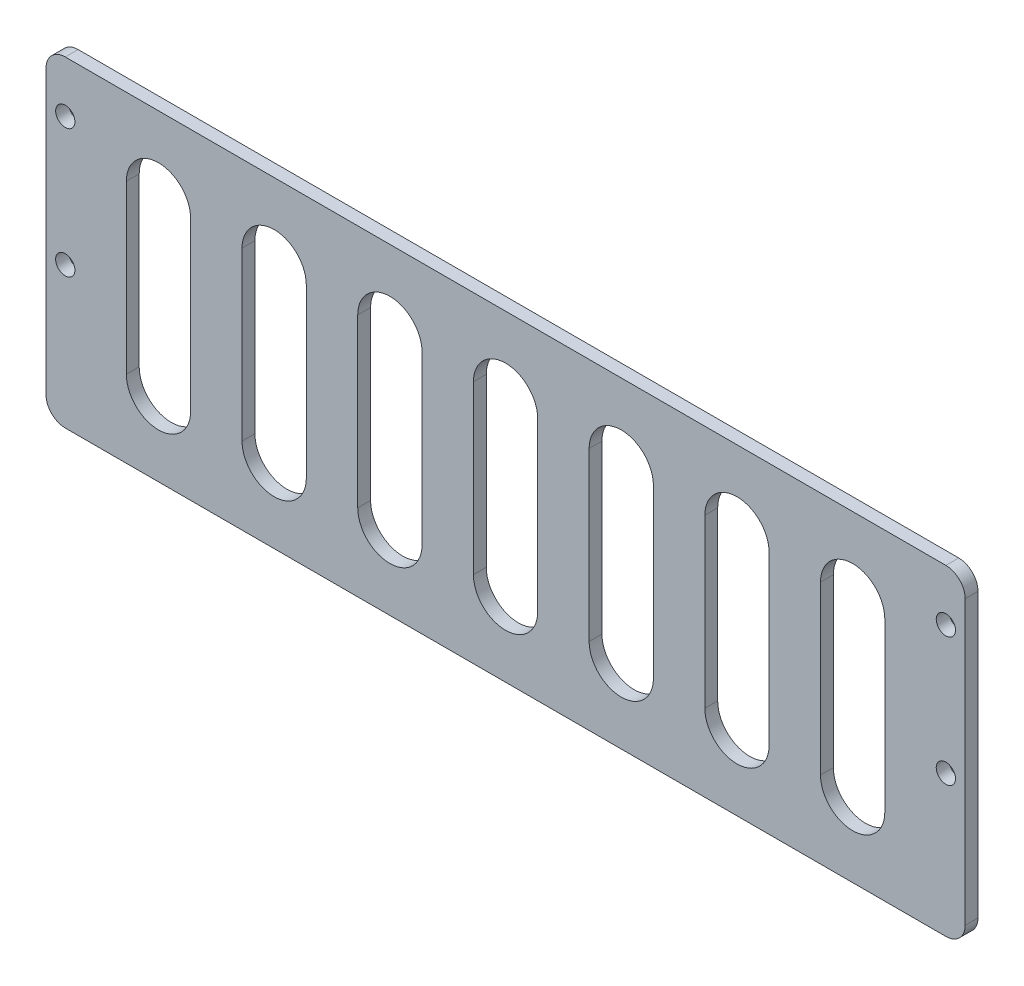
from build123d import *

# Parameters (mm, degrees)
SKETCH_1_W          = 143
SKETCH_1_H          = 50
EXTRUDE_1_DEPTH     = 2
FILLET_1_R          = 3
CUT_EXTRUDE_1_DEPTH = 10
SKETCH_7_R          = 1.5
CUT_EXTRUDE_2_DEPTH = 10


with BuildPart() as part:
    # 草图1 → 凸台-拉伸1 (new body)
    with BuildSketch(Plane.XY):
        Rectangle(SKETCH_1_W, SKETCH_1_H)
    extrude(amount=EXTRUDE_1_DEPTH)

    # 圆角1
    fillet_1_edges = [part.edges().sort_by_distance(p)[0] for p in [
        (-71.5, 25, 1),
        (71.5, 25, 1),
        (71.5, -25, 1),
        (-71.5, -25, 1),
    ]]
    fillet(fillet_1_edges, radius=FILLET_1_R)

    # 草图2 → 切除-拉伸1 (cut)
    with BuildSketch(Plane.XY.offset(2)):
        with BuildLine():
            Line((5, 13), (5, -13))
            ThreePointArc((5, -13), (0, -18), (-5, -13))
            Line((-5, -13), (-5, 13))
            ThreePointArc((-5, 13), (0, 18), (5, 13))
        make_face()
        with BuildLine():
            Line((23, 13), (23, -13))
            ThreePointArc((23, -13), (18, -18), (13, -13))
            Line((13, -13), (13, 13))
            ThreePointArc((13, 13), (18, 18), (23, 13))
        make_face()
        with BuildLine():
            Line((41, 13), (41, -13))
            ThreePointArc((41, -13), (36, -18), (31, -13))
            Line((31, -13), (31, 13))
            ThreePointArc((31, 13), (36, 18), (41, 13))
        make_face()
        with BuildLine():
            Line((59, 13), (59, -13))
            ThreePointArc((59, -13), (54, -18), (49, -13))
            Line((49, -13), (49, 13))
            ThreePointArc((49, 13), (54, 18), (59, 13))
        make_face()
        with BuildLine():
            Line((-59, 13), (-59, -13))
            ThreePointArc((-59, -13), (-54, -18), (-49, -13))
            Line((-49, -13), (-49, 13))
            ThreePointArc((-49, 13), (-54, 18), (-59, 13))
        make_face()
        with BuildLine():
            Line((-41, 13), (-41, -13))
            ThreePointArc((-41, -13), (-36, -18), (-31, -13))
            Line((-31, -13), (-31, 13))
            ThreePointArc((-31, 13), (-36, 18), (-41, 13))
        make_face()
        with BuildLine():
            Line((-23, 13), (-23, -13))
            ThreePointArc((-23, -13), (-18, -18), (-13, -13))
            Line((-13, -13), (-13, 13))
            ThreePointArc((-13, 13), (-18, 18), (-23, 13))
        make_face()
    extrude(amount=-CUT_EXTRUDE_1_DEPTH, mode=Mode.SUBTRACT)

    # 草图7 → 切除-拉伸2 (cut)
    with BuildSketch(Plane(origin=(0, 0, 0), x_dir=(-1, 0, 0), z_dir=(0, 0, -1))):
        with Locations((-68.5, -3)):
            Circle(SKETCH_7_R)
        with Locations((-68.5, 17)):
            Circle(SKETCH_7_R)
    cut_extrude_2 = extrude(amount=-CUT_EXTRUDE_2_DEPTH, mode=Mode.SUBTRACT)

    # 镜向2: 切除-拉伸2 across plane
    add(cut_extrude_2.mirror(Plane.ZY), mode=Mode.SUBTRACT)


solid = part.part
